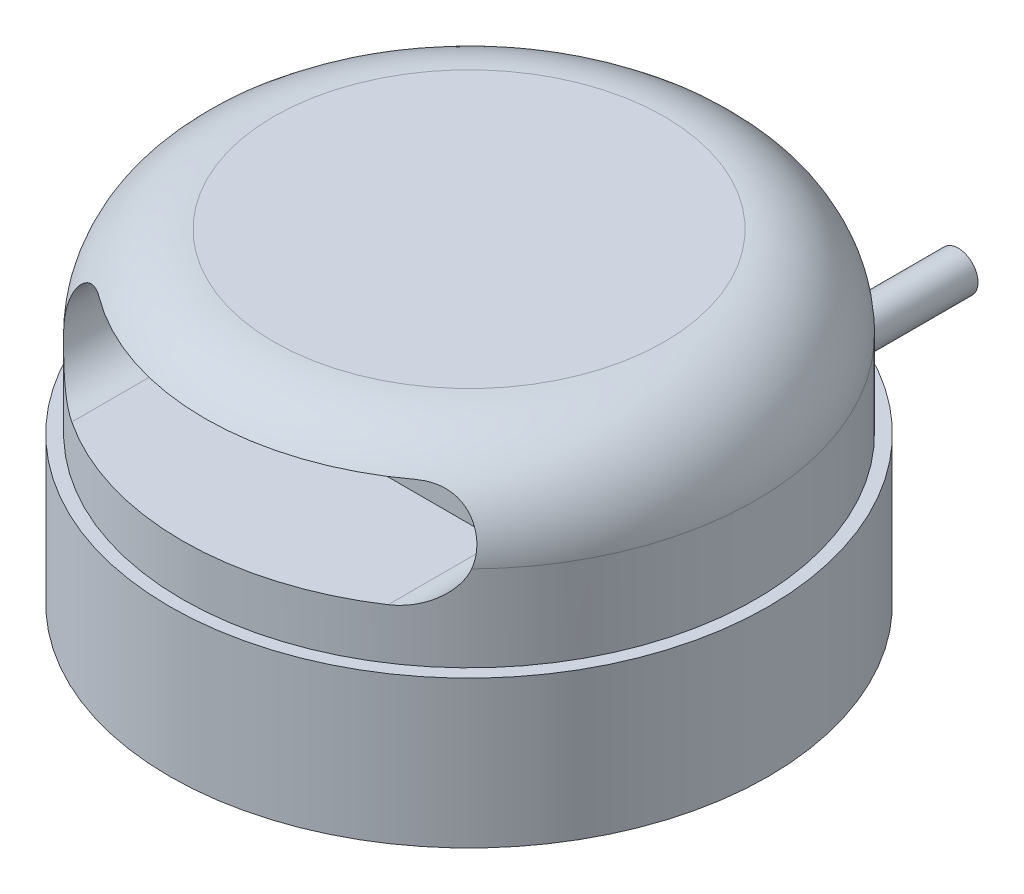
from build123d import *

# Parameters (mm, degrees)
ESQUISSE1_R                         = 37.85
BOSS_EXTRU_1_DEPTH                  = 18.6
ENL_V_MAT_EXTRU_1_DEPTH             = 20
D_GAGEMENT_M31_D                    = 3.4
D_GAGEMENT_M31_DEPTH                = 3
D_GAGEMENT_M31_TIP                  = 1.021463052
BOSS_EXTRU_2_DEPTH                  = 4
BOSS_EXTRU_2_DIRECTION_2_REACH      = 96.043
BOSS_EXTRU_2_DIRECTION_2_END_RADIUS = 37.85
ESQUISSE9_R                         = 2.5
BOSS_EXTRU_3_DEPTH                  = 20


with BuildPart() as part:
    # Esquisse1 → Boss.-Extru.1 (new body)
    with BuildSketch(Plane(origin=(0, 0, 0), x_dir=(1, 0, 0), z_dir=(0, 1, 0))):
        with Locations(Location((0, 0, 0), (0, 0, 270))):
            Circle(ESQUISSE1_R)
    extrude(amount=BOSS_EXTRU_1_DEPTH)

    # Esquisse2 → Révolution1 (revolve)
    with BuildSketch(Plane.XY, mode=Mode.PRIVATE) as r_volution1_sk:
        with BuildLine():
            Line((0, 18.6), (0, 41))
            Line((0, 41), (-24.682338214, 41))
            ThreePointArc((-24.682338214, 41), (-32.861910305, 37.611910305), (-36.25, 29.432338214))
            Line((-36.25, 29.432338214), (-36.25, 18.6))
            Line((-36.25, 18.6), (0, 18.6))
        make_face()
    revolve(r_volution1_sk.sketch.rotate(Axis((0, 18.6, 0), (0, 1, 0)), 270), axis=Axis((0, 18.6, 0), (0, 1, 0)))

    # Esquisse3 → Enlèv. mat.-Extru.1 (cut)
    with BuildSketch(Plane.XY.offset(36.25)):
        with BuildLine():
            Line((-20, 37), (20, 37))
            ThreePointArc((20, 37), (26, 31), (20, 25))
            Line((20, 25), (-20, 25))
            ThreePointArc((-20, 25), (-26, 31), (-20, 37))
        make_face()
    extrude(amount=-ENL_V_MAT_EXTRU_1_DEPTH, mode=Mode.SUBTRACT)

    # Dégagement M31
    with Locations(Plane(origin=(0, 0, 0), x_dir=(-1, 0, 0), z_dir=(0, -1, 0))):
        with Locations((20.859650045, -20.859650045), (-20.859650045, -20.859650045), (-20.859650045, 20.859650045), (20.859650045, 20.859650045)):
            Hole(D_GAGEMENT_M31_D / 2, depth=D_GAGEMENT_M31_DEPTH)
            with Locations((0, 0, -(D_GAGEMENT_M31_DEPTH + D_GAGEMENT_M31_TIP / 2))):  # 118° drill point
                Cone(0, D_GAGEMENT_M31_D / 2, D_GAGEMENT_M31_TIP, mode=Mode.SUBTRACT)

    # Esquisse8 → Boss.-Extru.2 (add)
    with BuildSketch(Plane.XY.offset(-37.85)):
        with BuildLine():
            Line((-1.5, 9.5), (1.5, 9.5))
            ThreePointArc((1.5, 9.5), (5.5, 5.5), (1.5, 1.5))
            Line((1.5, 1.5), (-1.5, 1.5))
            ThreePointArc((-1.5, 1.5), (-5.5, 5.5), (-1.5, 9.5))
        make_face()
    extrude(amount=-BOSS_EXTRU_2_DEPTH)

    # Boss.-Extru.2 direction 2: up to this cylinder (the profile starts outside it)
    boss_extru_2_direction_2_end = Plane(origin=(0, 5.5, 0), z_dir=(0, -1, 0)) * Cylinder(BOSS_EXTRU_2_DIRECTION_2_END_RADIUS, 268.786, mode=Mode.PRIVATE)
    # Esquisse8 → Boss.-Extru.2 direction 2 (add, up to the surface)
    with BuildSketch(Plane.XY.offset(-37.85), mode=Mode.PRIVATE) as boss_extru_2_direction_2_sk1:
        with BuildLine():
            Line((-1.5, 9.5), (1.5, 9.5))
            ThreePointArc((1.5, 9.5), (5.5, 5.5), (1.5, 1.5))
            Line((1.5, 1.5), (-1.5, 1.5))
            ThreePointArc((-1.5, 1.5), (-5.5, 5.5), (-1.5, 9.5))
        make_face()
    boss_extru_2_direction_2_tool1 = extrude(boss_extru_2_direction_2_sk1.sketch, amount=BOSS_EXTRU_2_DIRECTION_2_REACH, mode=Mode.PRIVATE) - boss_extru_2_direction_2_end
    add(boss_extru_2_direction_2_tool1.solids().sort_by_distance((0, 5.5, -37.85))[0])
    add(boss_extru_2_direction_2_tool1.solids().sort_by_distance((0, 5.5, -37.85))[1])

    # Esquisse9 → Boss.-Extru.3 (add)
    with BuildSketch(Plane(origin=(0, 0, -41.85), x_dir=(-1, 0, 0), z_dir=(0, 0, -1))):
        with Locations((0, 5.5)):
            Circle(ESQUISSE9_R)
    extrude(amount=BOSS_EXTRU_3_DEPTH)


solid = part.part
